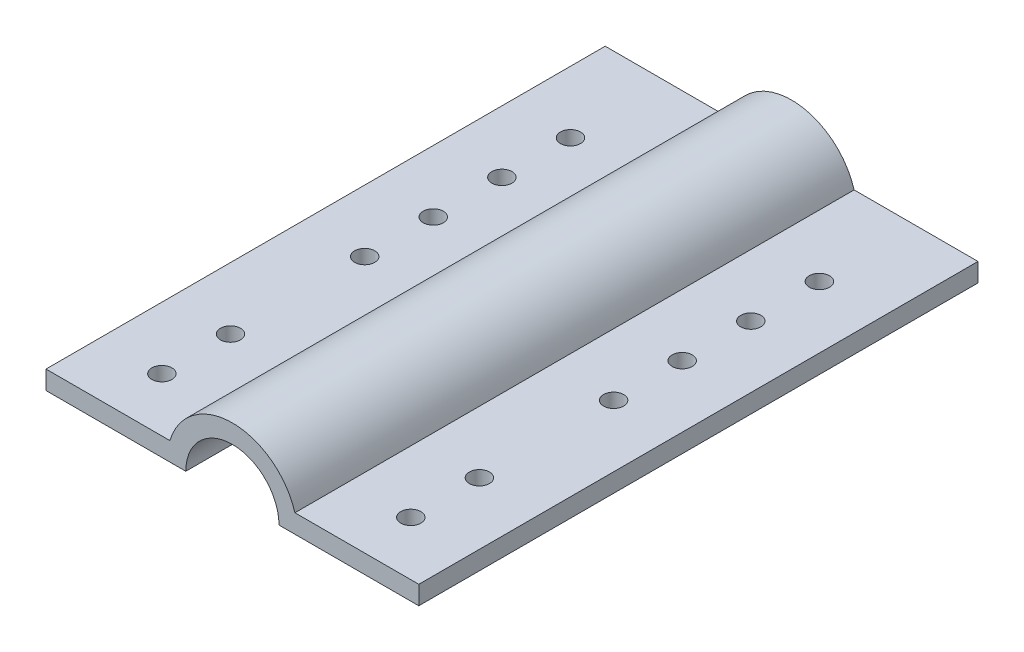
from build123d import *

# Parameters (mm, degrees)
BOSS_EXTRUDE1_DEPTH      = 100
BOSS_EXTRUDE1_DEPTH_BACK = 50
CUT_EXTRUDE2_REACH       = 115.345
SKETCH6_R                = 2.7


with BuildPart() as part:
    # Sketch1 → Boss-Extrude1 (new, two sides: drawn at the far end of the back side and taken through both)
    with BuildSketch(Plane.XY.offset(-BOSS_EXTRUDE1_DEPTH_BACK)):
        with BuildLine():
            Line((-12.5, 0), (-50, 0))
            Line((-50, 0), (-50, 5))
            Line((-50, 5), (-16.770509831, 5))
            ThreePointArc((-16.770509831, 5), (0, 17.5), (16.770509831, 5))
            Line((16.770509831, 5), (50, 5))
            Line((50, 5), (50, 0))
            Line((50, 0), (12.5, 0))
            ThreePointArc((12.5, 0), (0, 12.5), (-12.5, 0))
        make_face()
    extrude(amount=BOSS_EXTRUDE1_DEPTH + BOSS_EXTRUDE1_DEPTH_BACK)

    # Sweep1: sweep along a path in Sketch4
    with BuildLine(Plane.ZY.offset(12.5)) as sweep1_path:
        Line((50.0437673, 0), (48.0549131, -13.633099982))
    # Sketch3 → Sweep1 (sweep)
    with BuildSketch(Plane.XZ):
        with BuildLine():
            Line((-12.5, 71.352170208), (-12.5, 28.735364392))
            ThreePointArc((-12.5, 28.735364392), (-24.704210866, 50.0437673), (-12.5, 71.352170208))
        make_face()
        with BuildLine():
            Line((12.5, 71.352170208), (12.5, 28.735364392))
            ThreePointArc((12.5, 28.735364392), (24.704210866, 50.0437673), (12.5, 71.352170208))
        make_face()
    sweep(path=sweep1_path.line)

    # Sketch6 → Cut-Extrude2 (cut, up to next)
    with BuildSketch(Plane(origin=(0, 5, 0), x_dir=(1, 0, 0), z_dir=(0, 1, 0)), mode=Mode.PRIVATE) as cut_extrude2_sk1:
        with Locations(Location((-33.385254916, 24.07, 0), (0, 0, 180))):
            Circle(SKETCH6_R)
    cut_extrude2_tool1 = extrude(cut_extrude2_sk1.sketch, amount=-CUT_EXTRUDE2_REACH, mode=Mode.PRIVATE) & part.part
    # Sketch6 → Cut-Extrude2 (cut, up to next)
    with BuildSketch(Plane(origin=(0, 5, 0), x_dir=(1, 0, 0), z_dir=(0, 1, 0)), mode=Mode.PRIVATE) as cut_extrude2_sk2:
        with Locations(Location((-33.385254916, 5.67, 0), (0, 0, 180))):
            Circle(SKETCH6_R)
    cut_extrude2_tool2 = extrude(cut_extrude2_sk2.sketch, amount=-CUT_EXTRUDE2_REACH, mode=Mode.PRIVATE) & part.part
    # Sketch6 → Cut-Extrude2 (cut, up to next)
    with BuildSketch(Plane(origin=(0, 5, 0), x_dir=(1, 0, 0), z_dir=(0, 1, 0)), mode=Mode.PRIVATE) as cut_extrude2_sk3:
        with Locations(Location((-33.385254916, -12.73, 0), (0, 0, 180))):
            Circle(SKETCH6_R)
    cut_extrude2_tool3 = extrude(cut_extrude2_sk3.sketch, amount=-CUT_EXTRUDE2_REACH, mode=Mode.PRIVATE) & part.part
    # Sketch6 → Cut-Extrude2 (cut, up to next)
    with BuildSketch(Plane(origin=(0, 5, 0), x_dir=(1, 0, 0), z_dir=(0, 1, 0)), mode=Mode.PRIVATE) as cut_extrude2_sk4:
        with Locations(Location((-33.385254916, -31.13, 0), (0, 0, 180))):
            Circle(SKETCH6_R)
    cut_extrude2_tool4 = extrude(cut_extrude2_sk4.sketch, amount=-CUT_EXTRUDE2_REACH, mode=Mode.PRIVATE) & part.part
    # Sketch6 → Cut-Extrude2 (cut, up to next)
    with BuildSketch(Plane(origin=(0, 5, 0), x_dir=(1, 0, 0), z_dir=(0, 1, 0)), mode=Mode.PRIVATE) as cut_extrude2_sk5:
        with Locations(Location((-33.385254916, -67.13, 0), (0, 0, 180))):
            Circle(SKETCH6_R)
    cut_extrude2_tool5 = extrude(cut_extrude2_sk5.sketch, amount=-CUT_EXTRUDE2_REACH, mode=Mode.PRIVATE) & part.part
    # Sketch6 → Cut-Extrude2 (cut, up to next)
    with BuildSketch(Plane(origin=(0, 5, 0), x_dir=(1, 0, 0), z_dir=(0, 1, 0)), mode=Mode.PRIVATE) as cut_extrude2_sk6:
        with Locations(Location((-33.385254916, -85.53, 0), (0, 0, 180))):
            Circle(SKETCH6_R)
    cut_extrude2_tool6 = extrude(cut_extrude2_sk6.sketch, amount=-CUT_EXTRUDE2_REACH, mode=Mode.PRIVATE) & part.part
    # Sketch6 → Cut-Extrude2 (cut, up to next)
    with BuildSketch(Plane(origin=(0, 5, 0), x_dir=(1, 0, 0), z_dir=(0, 1, 0)), mode=Mode.PRIVATE) as cut_extrude2_sk7:
        with Locations(Location((33.385254916, 24.07, 0), (0, 0, 180))):
            Circle(SKETCH6_R)
    cut_extrude2_tool7 = extrude(cut_extrude2_sk7.sketch, amount=-CUT_EXTRUDE2_REACH, mode=Mode.PRIVATE) & part.part
    # Sketch6 → Cut-Extrude2 (cut, up to next)
    with BuildSketch(Plane(origin=(0, 5, 0), x_dir=(1, 0, 0), z_dir=(0, 1, 0)), mode=Mode.PRIVATE) as cut_extrude2_sk8:
        with Locations(Location((33.385254916, 5.67, 0), (0, 0, 180))):
            Circle(SKETCH6_R)
    cut_extrude2_tool8 = extrude(cut_extrude2_sk8.sketch, amount=-CUT_EXTRUDE2_REACH, mode=Mode.PRIVATE) & part.part
    # Sketch6 → Cut-Extrude2 (cut, up to next)
    with BuildSketch(Plane(origin=(0, 5, 0), x_dir=(1, 0, 0), z_dir=(0, 1, 0)), mode=Mode.PRIVATE) as cut_extrude2_sk9:
        with Locations(Location((33.385254916, -31.13, 0), (0, 0, 180))):
            Circle(SKETCH6_R)
    cut_extrude2_tool9 = extrude(cut_extrude2_sk9.sketch, amount=-CUT_EXTRUDE2_REACH, mode=Mode.PRIVATE) & part.part
    # Sketch6 → Cut-Extrude2 (cut, up to next)
    with BuildSketch(Plane(origin=(0, 5, 0), x_dir=(1, 0, 0), z_dir=(0, 1, 0)), mode=Mode.PRIVATE) as cut_extrude2_sk10:
        with Locations(Location((33.385254916, -67.13, 0), (0, 0, 180))):
            Circle(SKETCH6_R)
    cut_extrude2_tool10 = extrude(cut_extrude2_sk10.sketch, amount=-CUT_EXTRUDE2_REACH, mode=Mode.PRIVATE) & part.part
    # Sketch6 → Cut-Extrude2 (cut, up to next)
    with BuildSketch(Plane(origin=(0, 5, 0), x_dir=(1, 0, 0), z_dir=(0, 1, 0)), mode=Mode.PRIVATE) as cut_extrude2_sk11:
        with Locations(Location((33.385254916, -85.53, 0), (0, 0, 180))):
            Circle(SKETCH6_R)
    cut_extrude2_tool11 = extrude(cut_extrude2_sk11.sketch, amount=-CUT_EXTRUDE2_REACH, mode=Mode.PRIVATE) & part.part
    # Sketch6 → Cut-Extrude2 (cut, up to next)
    with BuildSketch(Plane(origin=(0, 5, 0), x_dir=(1, 0, 0), z_dir=(0, 1, 0)), mode=Mode.PRIVATE) as cut_extrude2_sk12:
        with Locations(Location((33.385254916, -12.73, 0), (0, 0, 180))):
            Circle(SKETCH6_R)
    cut_extrude2_tool12 = extrude(cut_extrude2_sk12.sketch, amount=-CUT_EXTRUDE2_REACH, mode=Mode.PRIVATE) & part.part
    add(cut_extrude2_tool1.solids().sort_by_distance((-33.385255, 5, -24.07))[0], mode=Mode.SUBTRACT)
    add(cut_extrude2_tool2.solids().sort_by_distance((-33.385255, 5, -5.67))[0], mode=Mode.SUBTRACT)
    add(cut_extrude2_tool3.solids().sort_by_distance((-33.385255, 5, 12.73))[0], mode=Mode.SUBTRACT)
    add(cut_extrude2_tool4.solids().sort_by_distance((-33.385255, 5, 31.13))[0], mode=Mode.SUBTRACT)
    add(cut_extrude2_tool5.solids().sort_by_distance((-33.385255, 5, 67.13))[0], mode=Mode.SUBTRACT)
    add(cut_extrude2_tool6.solids().sort_by_distance((-33.385255, 5, 85.53))[0], mode=Mode.SUBTRACT)
    add(cut_extrude2_tool7.solids().sort_by_distance((33.385255, 5, -24.07))[0], mode=Mode.SUBTRACT)
    add(cut_extrude2_tool8.solids().sort_by_distance((33.385255, 5, -5.67))[0], mode=Mode.SUBTRACT)
    add(cut_extrude2_tool9.solids().sort_by_distance((33.385255, 5, 31.13))[0], mode=Mode.SUBTRACT)
    add(cut_extrude2_tool10.solids().sort_by_distance((33.385255, 5, 67.13))[0], mode=Mode.SUBTRACT)
    add(cut_extrude2_tool11.solids().sort_by_distance((33.385255, 5, 85.53))[0], mode=Mode.SUBTRACT)
    add(cut_extrude2_tool12.solids().sort_by_distance((33.385255, 5, 12.73))[0], mode=Mode.SUBTRACT)


solid = part.part
